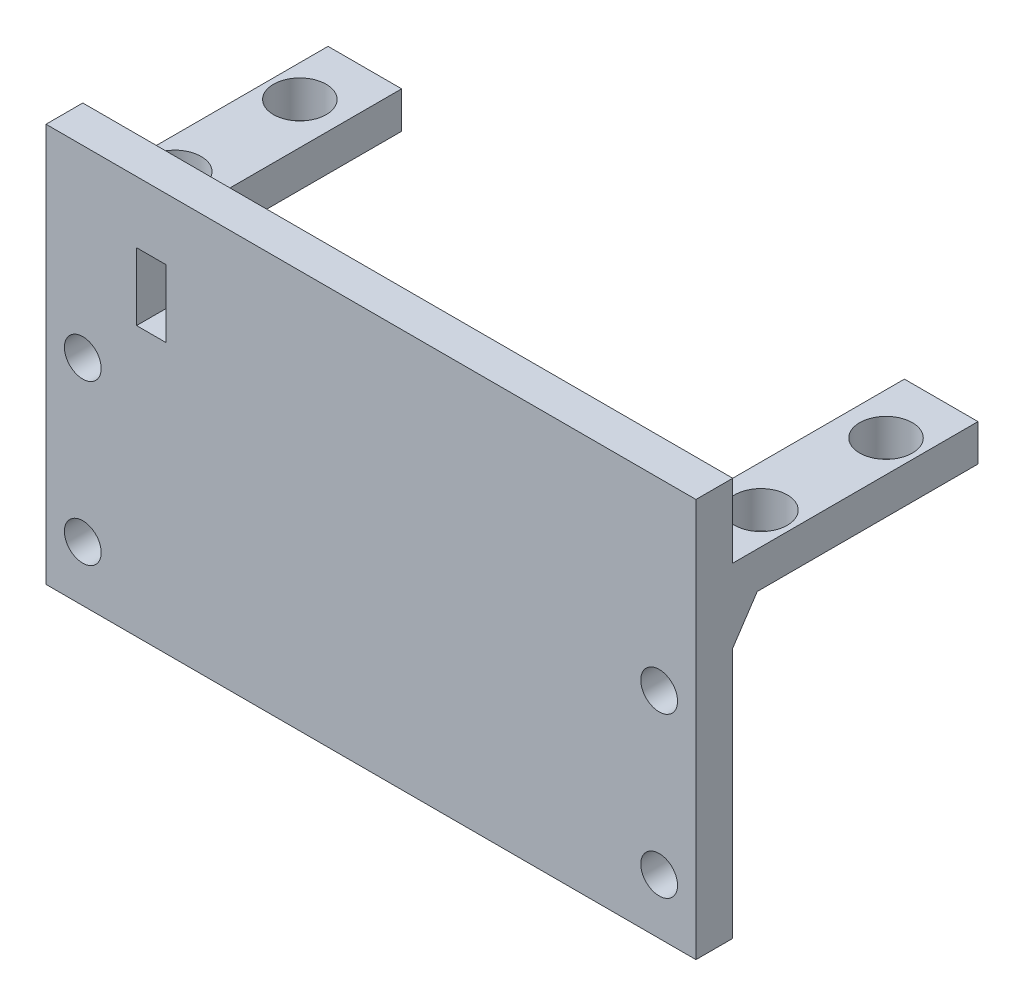
from build123d import *

# Parameters (mm, degrees)
SKETCH1_W           = 53
SKETCH1_H           = 32.5
BOSS_EXTRUDE1_DEPTH = 3
SKETCH5_W           = 6
SKETCH5_H           = 3
BOSS_EXTRUDE2_DEPTH = 20
SKETCH6_R           = 2.15
CUT_EXTRUDE3_DEPTH  = 10
SKETCH7_W           = 2.4
SKETCH7_H           = 5.5
CUT_EXTRUDE6_DEPTH  = 10
SKETCH8_R           = 1.5
CUT_EXTRUDE7_DEPTH  = 10
BOSS_EXTRUDE3_DEPTH = 6
BOSS_EXTRUDE4_DEPTH = 6


with BuildPart() as part:
    # Sketch1 → Boss-Extrude1 (new body)
    with BuildSketch(Plane.XY):
        with Locations((9.74034322, 3.310344828)):
            Rectangle(SKETCH1_W, SKETCH1_H)
    extrude(amount=BOSS_EXTRUDE1_DEPTH)

    # Sketch5 → Boss-Extrude2 (add)
    with BuildSketch(Plane(origin=(0, 0, 0), x_dir=(-1, 0, 0), z_dir=(0, 0, -1))):
        with Locations((-33.24034322, 12.060344828)):
            Rectangle(SKETCH5_W, SKETCH5_H)
        with Locations((13.75965678, 12.060344828)):
            Rectangle(SKETCH5_W, SKETCH5_H)
    extrude(amount=BOSS_EXTRUDE2_DEPTH)

    # Sketch6 → Cut-Extrude3 (cut)
    with BuildSketch(Plane(origin=(0, 13.560344828, 0), x_dir=(1, 0, 0), z_dir=(0, 1, 0))):
        with Locations(Location((33.64034322, 4.9, 0), (0, 0, 270))):
            Circle(SKETCH6_R)
        with Locations(Location((33.64034322, 15.1, 0), (0, 0, 270))):
            Circle(SKETCH6_R)
        with Locations(Location((-14.15965678, 4.9, 0), (0, 0, 270))):
            Circle(SKETCH6_R)
        with Locations(Location((-14.15965678, 15.1, 0), (0, 0, 270))):
            Circle(SKETCH6_R)
    extrude(amount=-CUT_EXTRUDE3_DEPTH, mode=Mode.SUBTRACT)

    # Sketch7 → Cut-Extrude6 (cut)
    with BuildSketch(Plane(origin=(0, 0, 0), x_dir=(-1, 0, 0), z_dir=(0, 0, -1))):
        with Locations((8.172781941, 11.783549127)):
            Rectangle(SKETCH7_W, SKETCH7_H)
    extrude(amount=-CUT_EXTRUDE6_DEPTH, mode=Mode.SUBTRACT)

    # Sketch8 → Cut-Extrude7 (cut)
    with BuildSketch(Plane(origin=(0, 0, 0), x_dir=(-1, 0, 0), z_dir=(0, 0, -1))):
        with Locations((-33.24034322, 4.560344828)):
            Circle(SKETCH8_R)
        with Locations((-33.24034322, -8.439655172)):
            Circle(SKETCH8_R)
        with Locations((13.75965678, -8.439655172)):
            Circle(SKETCH8_R)
        with Locations((13.75965678, 4.560344828)):
            Circle(SKETCH8_R)
    extrude(amount=-CUT_EXTRUDE7_DEPTH, mode=Mode.SUBTRACT)

    # Sketch9 → Boss-Extrude3 (add)
    with BuildSketch(Plane.ZY.offset(16.75965678)):
        Polygon((-2, 10.560344828), (0, 10.560344828), (0, 7.560344828), align=None)
    extrude(amount=-BOSS_EXTRUDE3_DEPTH)

    # Sketch10 → Boss-Extrude4 (add)
    with BuildSketch(Plane(origin=(36.24034322, 0, 0), x_dir=(0, 0, -1), z_dir=(1, 0, 0))):
        Polygon((2, 10.560344828), (0, 10.560344828), (0, 7.560344828), align=None)
    extrude(amount=-BOSS_EXTRUDE4_DEPTH)


solid = part.part
